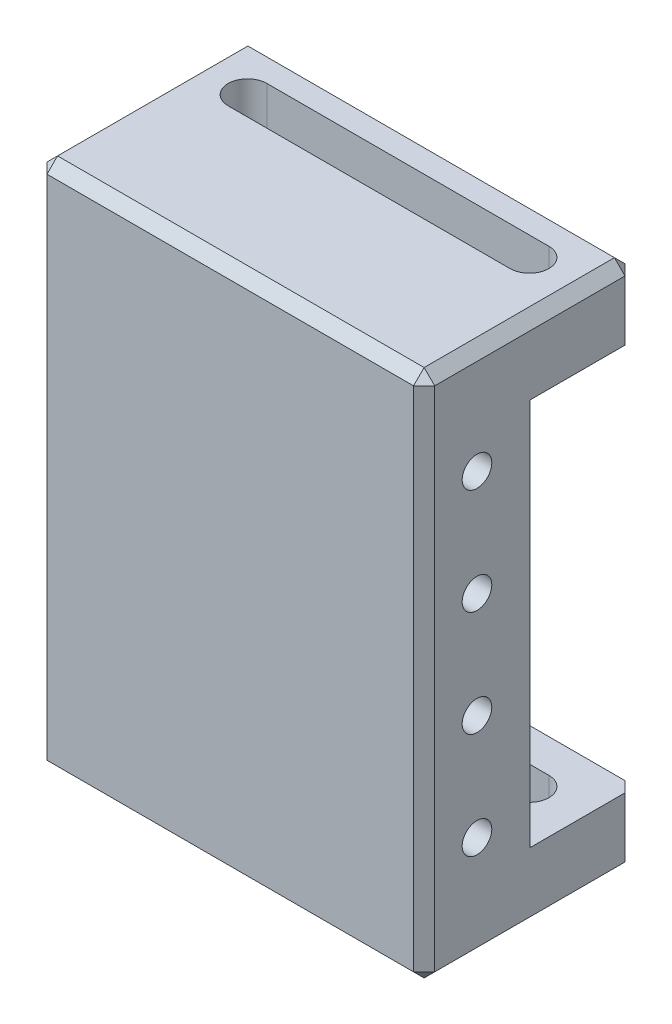
from build123d import *

# Parameters (mm, degrees)
SKETCH1_W                  = 55
SKETCH1_H                  = 65
BOSS_EXTRUDE1_DEPTH        = 10
SKETCH2_W                  = 55
SKETCH2_H                  = 5
BOSS_EXTRUDE2_DEPTH        = 15
CUT_EXTRUDE1_DEPTH         = 104
SKETCH4_W                  = 55
SKETCH4_H                  = 65
BOSS_EXTRUDE3_DEPTH        = 5
M5_TAPPED_HOLE2_AT_2_COUNT = 2
M5_TAPPED_HOLE2_AT_2_PITCH = 15
M5_TAPPED_HOLE2_AT_3_COUNT = 2
M5_TAPPED_HOLE2_AT_3_PITCH = 30
M5_TAPPED_HOLE2_AT_4_COUNT = 2
M5_TAPPED_HOLE2_AT_4_PITCH = 45
BOSS_EXTRUDE4_START        = 5
SKETCH13_W                 = 55
SKETCH13_H                 = 30
BOSS_EXTRUDE4_DEPTH        = 5
CHAMFER2_SIZE              = 1.5


with BuildPart() as part:
    # Sketch1 → Boss-Extrude1 (new body)
    with BuildSketch(Plane.XY):
        Rectangle(SKETCH1_W, SKETCH1_H)
    extrude(amount=BOSS_EXTRUDE1_DEPTH)

    # Sketch2 → Boss-Extrude2 (add)
    with BuildSketch(Plane(origin=(0, 0, 0), x_dir=(-1, 0, 0), z_dir=(0, 0, -1))):
        with Locations((0, 30)):
            Rectangle(SKETCH2_W, SKETCH2_H)
        with Locations((0, -30)):
            Rectangle(SKETCH2_W, SKETCH2_H)
    extrude(amount=BOSS_EXTRUDE2_DEPTH)

    # Sketch3 → Cut-Extrude1 (cut)
    with BuildSketch(Plane.XZ.offset(32.5)):
        with BuildLine():
            Line((-20.05, -4.75), (19.95, -4.75))
            ThreePointArc((19.95, -4.75), (22.7, -7.5), (19.95, -10.25))
            Line((19.95, -10.25), (-20.05, -10.25))
            ThreePointArc((-20.05, -10.25), (-22.8, -7.5), (-20.05, -4.75))
        make_face()
    extrude(amount=-CUT_EXTRUDE1_DEPTH, mode=Mode.SUBTRACT)

    # Sketch4 → Boss-Extrude3 (add)
    with BuildSketch(Plane.XY.offset(10)):
        Rectangle(SKETCH4_W, SKETCH4_H)
    extrude(amount=BOSS_EXTRUDE3_DEPTH)

    # Sketch12 → M5 Tapped Hole2 (revolve, cut)
    with BuildSketch(Plane(origin=(27.5, 22.5, 7.5), x_dir=(0, 0, -1), z_dir=(0, 1, 0))):
        Polygon((0, 0), (0, 15.2618073), (2.1, 14), (2.1, 0), align=None)
    m5_tapped_hole2 = revolve(axis=Axis((33.85, 22.5, 7.5), (-1, 0, 0)), mode=Mode.SUBTRACT)

    # M5 Tapped Hole2 at 2: M5 Tapped Hole2 ×2
    with Locations(*[(0, -i * M5_TAPPED_HOLE2_AT_2_PITCH, 0) for i in range(1, M5_TAPPED_HOLE2_AT_2_COUNT)]):
        add(m5_tapped_hole2, mode=Mode.SUBTRACT)

    # M5 Tapped Hole2 at 3: M5 Tapped Hole2 ×2
    with Locations(*[(0, -i * M5_TAPPED_HOLE2_AT_3_PITCH, 0) for i in range(1, M5_TAPPED_HOLE2_AT_3_COUNT)]):
        add(m5_tapped_hole2, mode=Mode.SUBTRACT)

    # M5 Tapped Hole2 at 4: M5 Tapped Hole2 ×2
    with Locations(*[(0, -i * M5_TAPPED_HOLE2_AT_4_PITCH, 0) for i in range(1, M5_TAPPED_HOLE2_AT_4_COUNT)]):
        add(m5_tapped_hole2, mode=Mode.SUBTRACT)

    # Mirror2: M5 Tapped Hole2 across plane
    add(m5_tapped_hole2.mirror(Plane(origin=(0, 0, 0), x_dir=(0, 0, 1), z_dir=(1, 0, 0))), mode=Mode.SUBTRACT)

    # Mirror2 copy 1 sketch → Mirror2 copy 1 (revolve, cut)
    with BuildSketch(Plane(origin=(-27.5, 7.5, 7.499975629), x_dir=(0, 0, -1), z_dir=(0, 1, 0))):
        Polygon((0, 0), (0, -15.2618073), (2.1, -14), (2.1, 0), align=None)
    revolve(axis=Axis((-33.85, 7.5, 7.499975629), (-1, 0, 0)), mode=Mode.SUBTRACT)

    # Mirror2 copy 2 sketch → Mirror2 copy 2 (revolve, cut)
    with BuildSketch(Plane(origin=(-27.5, -7.5, 7.499949533), x_dir=(0, 0, -1), z_dir=(0, 1, 0))):
        Polygon((0, 0), (0, -15.2618073), (2.1, -14), (2.1, 0), align=None)
    revolve(axis=Axis((-33.85, -7.5, 7.499949533), (-1, 0, 0)), mode=Mode.SUBTRACT)

    # Mirror2 copy 3 sketch → Mirror2 copy 3 (revolve, cut)
    with BuildSketch(Plane(origin=(-27.5, -22.5, 7.499923436), x_dir=(0, 0, -1), z_dir=(0, 1, 0))):
        Polygon((0, 0), (0, -15.2618073), (2.1, -14), (2.1, 0), align=None)
    revolve(axis=Axis((-33.85, -22.5, 7.499923436), (-1, 0, 0)), mode=Mode.SUBTRACT)

    # Sketch13 → Boss-Extrude4 (add)
    with BuildSketch(Plane.XZ.offset(32.5).offset(BOSS_EXTRUDE4_START)):
        Rectangle(SKETCH13_W, SKETCH13_H)
        with BuildLine():
            Line((-20.05, -4.75), (19.95, -4.75))
            ThreePointArc((19.95, -4.75), (22.7, -7.5), (19.95, -10.25))
            Line((19.95, -10.25), (-20.05, -10.25))
            ThreePointArc((-20.05, -10.25), (-22.8, -7.5), (-20.05, -4.75))
        make_face(mode=Mode.SUBTRACT)
    boss_extrude4 = extrude(amount=-BOSS_EXTRUDE4_DEPTH)

    # Mirror3: Boss-Extrude4 across plane
    add(boss_extrude4.mirror(Plane(origin=(0, 0, 0), x_dir=(0, 0, 1), z_dir=(0, -1, 0))))

    # Chamfer2
    chamfer2_edges = [part.edges().sort_by_distance(p)[0] for p in [
        (-27.5, -37.5, 0),
        (0, -37.5, -15),
        (27.5, -37.5, 0),
        (0, -37.5, 15),
        (-27.5, 37.5, 0),
        (0, 37.5, 15),
        (27.5, 37.5, 0),
        (0, 37.5, -15),
        (27.5, 32.5, -15),
        (-27.5, 32.5, -15),
        (27.5, -32.5, -15),
        (-27.5, -32.5, -15),
        (-27.5, 0, 15),
        (27.5, 0, 15),
    ]]
    chamfer(chamfer2_edges, length=CHAMFER2_SIZE)


solid = part.part
